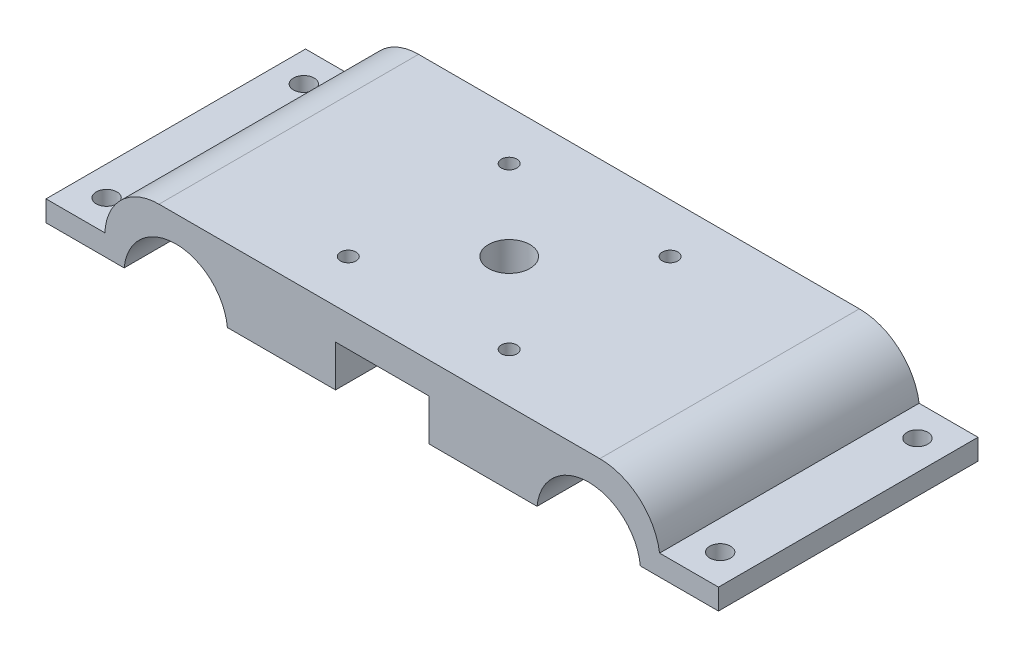
from build123d import *

# Parameters (mm, degrees)
ESTRUSIONE_ESTRUSIONE1_DEPTH = 50
SCHIZZO2_R                   = 2
TAGLIO_ESTRUSIONE1_DEPTH     = 92.821204916
SCHIZZO3_W                   = 18
SCHIZZO3_H                   = 9
TAGLIO_ESTRUSIONE2_DEPTH     = 35
SCHIZZO4_R                   = 4
SCHIZZO4_R_2                 = 1.5
TAGLIO_ESTRUSIONE3_DEPTH     = 93.4993712
SCHIZZO5_W                   = 129.55
SCHIZZO5_H                   = 1
TAGLIO_ESTRUSIONE4_DEPTH     = 94.767096332


with BuildPart() as part:
    # Schizzo1 → Estrusione-Estrusione1 (new body)
    with BuildSketch(Plane.XY):
        with BuildLine():
            Line((-41.361860063, 6.474046711), (18.188139937, 6.474046711))
            ThreePointArc((18.188139937, 6.474046711), (28.188139937, 16.474046711), (38.188139937, 6.474046711))
            Line((38.188139937, 6.474046711), (53.188139937, 6.474046711))
            Line((53.188139937, 6.474046711), (53.188139937, 11.474046711))
            Line((53.188139937, 11.474046711), (41.848393975, 11.474046711))
            ThreePointArc((41.848393975, 11.474046711), (37.956863927, 18.625242568), (30.330074087, 21.474046711))
            Line((30.330074087, 21.474046711), (-54.59096633, 21.474046711))
            ThreePointArc((-54.59096633, 21.474046711), (-61.816076084, 18.57022327), (-65.022114101, 11.474046711))
            Line((-65.022114101, 11.474046711), (-76.361860063, 11.474046711))
            Line((-76.361860063, 11.474046711), (-76.361860063, 6.474046711))
            Line((-76.361860063, 6.474046711), (-61.361860063, 6.474046711))
            ThreePointArc((-61.361860063, 6.474046711), (-51.361860063, 16.474046711), (-41.361860063, 6.474046711))
        make_face()
    extrude(amount=ESTRUSIONE_ESTRUSIONE1_DEPTH)

    # Schizzo2 → Taglio-Estrusione1 (cut, through all)
    with BuildSketch(Plane(origin=(0, 11.474046711, 0), x_dir=(1, 0, 0), z_dir=(0, 1, 0))):
        with Locations(Location((-70.691860063, -6, 0), (0, 0, 180))):
            Circle(SCHIZZO2_R)
        with Locations(Location((-70.691860063, -44, 0), (0, 0, 180))):
            Circle(SCHIZZO2_R)
        with Locations(Location((47.518139937, -6, 0), (0, 0, 180))):
            Circle(SCHIZZO2_R)
        with Locations(Location((47.518139937, -44, 0), (0, 0, 180))):
            Circle(SCHIZZO2_R)
    extrude(amount=-TAGLIO_ESTRUSIONE1_DEPTH, mode=Mode.SUBTRACT)

    # Schizzo3 → Taglio-Estrusione2 (cut)
    with BuildSketch(Plane.XY.offset(50)):
        with Locations((-11.586860063, 10.974046711)):
            Rectangle(SCHIZZO3_W, SCHIZZO3_H)
    extrude(amount=-TAGLIO_ESTRUSIONE2_DEPTH, mode=Mode.SUBTRACT)

    # Schizzo4 → Taglio-Estrusione3 (cut, through all)
    with BuildSketch(Plane(origin=(0, 21.474046711, 0), x_dir=(1, 0, 0), z_dir=(0, 1, 0))):
        with Locations(Location((-12.130446122, -25, 0), (0, 0, 180))):
            Circle(SCHIZZO4_R)
        with Locations(Location((-27.630446122, -9.5, 0), (0, 0, 180))):
            Circle(SCHIZZO4_R_2)
        with Locations(Location((3.369553878, -9.5, 0), (0, 0, 180))):
            Circle(SCHIZZO4_R_2)
        with Locations(Location((3.369553878, -40.5, 0), (0, 0, 180))):
            Circle(SCHIZZO4_R_2)
        with Locations(Location((-27.630446122, -40.5, 0), (0, 0, 180))):
            Circle(SCHIZZO4_R_2)
    extrude(amount=-TAGLIO_ESTRUSIONE3_DEPTH, mode=Mode.SUBTRACT)

    # Schizzo5 → Taglio-Estrusione4 (cut, through all)
    with BuildSketch(Plane.XY.offset(50)):
        with Locations((-11.586860063, 6.974046711)):
            Rectangle(SCHIZZO5_W, SCHIZZO5_H)
    extrude(amount=-TAGLIO_ESTRUSIONE4_DEPTH, mode=Mode.SUBTRACT)


solid = part.part
